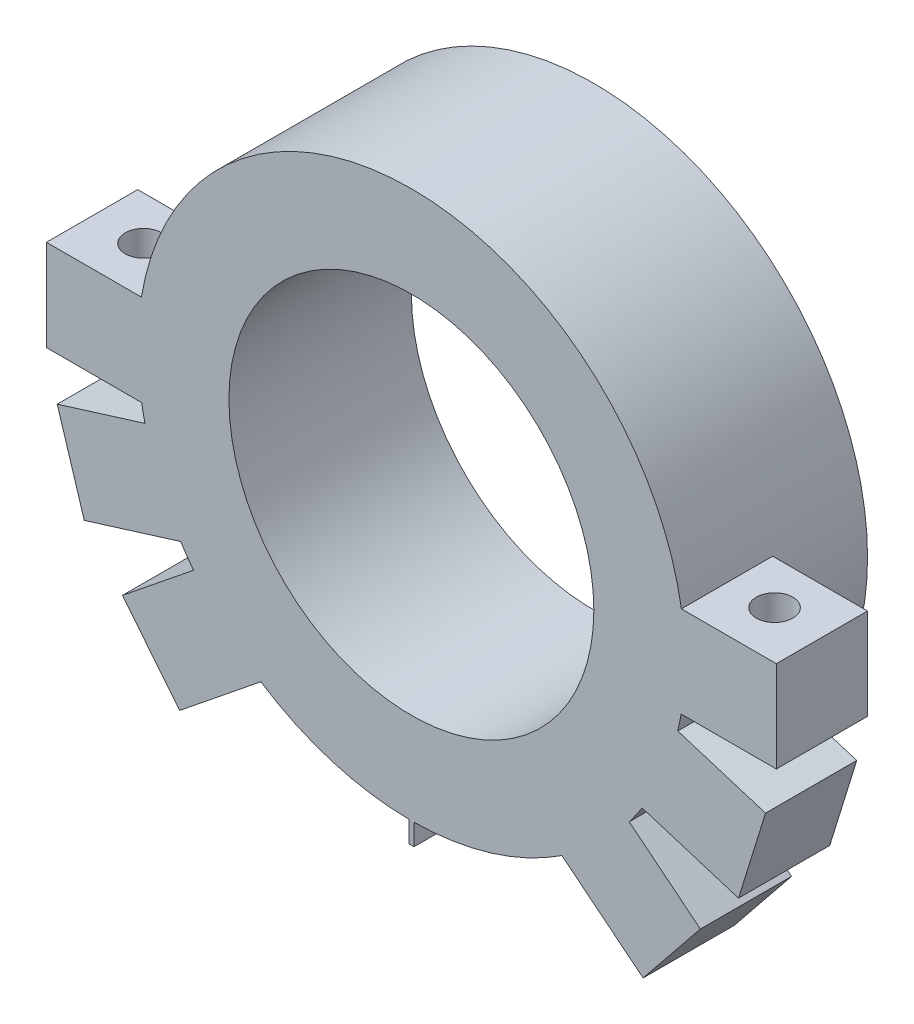
from build123d import *

# Parameters (mm, degrees)
ESQUISSE1_R             = 15
ESQUISSE1_R_2           = 10
BOSS_EXTRU_1_DEPTH      = 10
ESQUISSE2_W             = 7
ESQUISSE2_H             = 5
ESQUISSE2_W_2           = 0.284758048
ESQUISSE2_H_2           = 1.526135502
BOSS_EXTRU_2_DEPTH      = 5
ESQUISSE3_R             = 1
ENL_V_MAT_EXTRU_1_DEPTH = 10
ESQUISSE4_R             = 1
ENL_V_MAT_EXTRU_2_DEPTH = 7
ESQUISSE5_R             = 1
ENL_V_MAT_EXTRU_3_DEPTH = 7


with BuildPart() as part:
    # Esquisse1 → Boss.-Extru.1 (new body)
    with BuildSketch(Plane.XY):
        Circle(ESQUISSE1_R)
        Circle(ESQUISSE1_R_2, mode=Mode.SUBTRACT)
    extrude(amount=BOSS_EXTRU_1_DEPTH)

    # Esquisse2 → Boss.-Extru.2 (add)
    with BuildSketch(Plane.XY.offset(10)):
        with Locations((-16.5, -0.045599179)):
            Rectangle(ESQUISSE2_W, ESQUISSE2_H)
        Polygon((-12.723746603, -2.860261308), (-11.24279347, -7.635905538), (-17.928695393, -9.709239924), (-19.409648526, -4.933595693), align=None)
        Polygon((-10.38626352, -7.829614824), (-7.248762671, -11.722696948), (-12.699077643, -16.115198137), (-15.836578493, -12.222116013), align=None)
        Polygon((15.836578493, -12.222116013), (12.699077643, -16.115198137), (7.248762671, -11.722696948), (10.38626352, -7.829614824), align=None)
        Polygon((19.409648526, -4.933595693), (17.928695393, -9.709239924), (11.24279347, -7.635905538), (12.723746603, -2.860261308), align=None)
        with Locations((16.5, -0.045599179)):
            Rectangle(ESQUISSE2_W, ESQUISSE2_H)
        with Locations((0, -15.401311239)):
            Rectangle(ESQUISSE2_W_2, ESQUISSE2_H_2)
    extrude(amount=-BOSS_EXTRU_2_DEPTH)

    # Esquisse3 → Enlèv. mat.-Extru.1 (cut)
    with BuildSketch(Plane.XZ.offset(2.545599179)):
        with Locations((-17.292317554, 7.389299581)):
            Circle(ESQUISSE3_R)
    enl_v_mat_extru_1 = extrude(amount=-ENL_V_MAT_EXTRU_1_DEPTH, mode=Mode.SUBTRACT)

    # Esquisse4 → Enlèv. mat.-Extru.2 (cut)
    with BuildSketch(Plane(origin=(1.17388153, -3.785427393, 0), x_dir=(0.955128846150379, 0.2961906265421742, 0), z_dir=(0.2961906265421742, -0.955128846150379, 0))):
        with Locations((-17.565905228, 7.267460252)):
            Circle(ESQUISSE4_R)
    enl_v_mat_extru_2 = extrude(amount=-ENL_V_MAT_EXTRU_2_DEPTH, mode=Mode.SUBTRACT)

    # Esquisse5 → Enlèv. mat.-Extru.3 (cut)
    with BuildSketch(Plane(origin=(2.873250851, -3.56519474, 0), x_dir=(0.778616424708494, 0.6275001698598672, 0), z_dir=(0.6275001698598671, -0.7786164247084939, 0))):
        with Locations((-16.898350616, 6.935079558)):
            Circle(ESQUISSE5_R)
    enl_v_mat_extru_3 = extrude(amount=-ENL_V_MAT_EXTRU_3_DEPTH, mode=Mode.SUBTRACT)

    # Symétrie1: Enlèv. mat.-Extru.1, Enlèv. mat.-Extru.2, Enlèv. mat.-Extru.3 across plane
    add(enl_v_mat_extru_1.mirror(Plane(origin=(0, 0, 0), x_dir=(0, 0, 1), z_dir=(1, 0, 0))), mode=Mode.SUBTRACT)
    add(enl_v_mat_extru_2.mirror(Plane(origin=(0, 0, 0), x_dir=(0, 0, 1), z_dir=(1, 0, 0))), mode=Mode.SUBTRACT)
    add(enl_v_mat_extru_3.mirror(Plane(origin=(0, 0, 0), x_dir=(0, 0, 1), z_dir=(1, 0, 0))), mode=Mode.SUBTRACT)


solid = part.part
